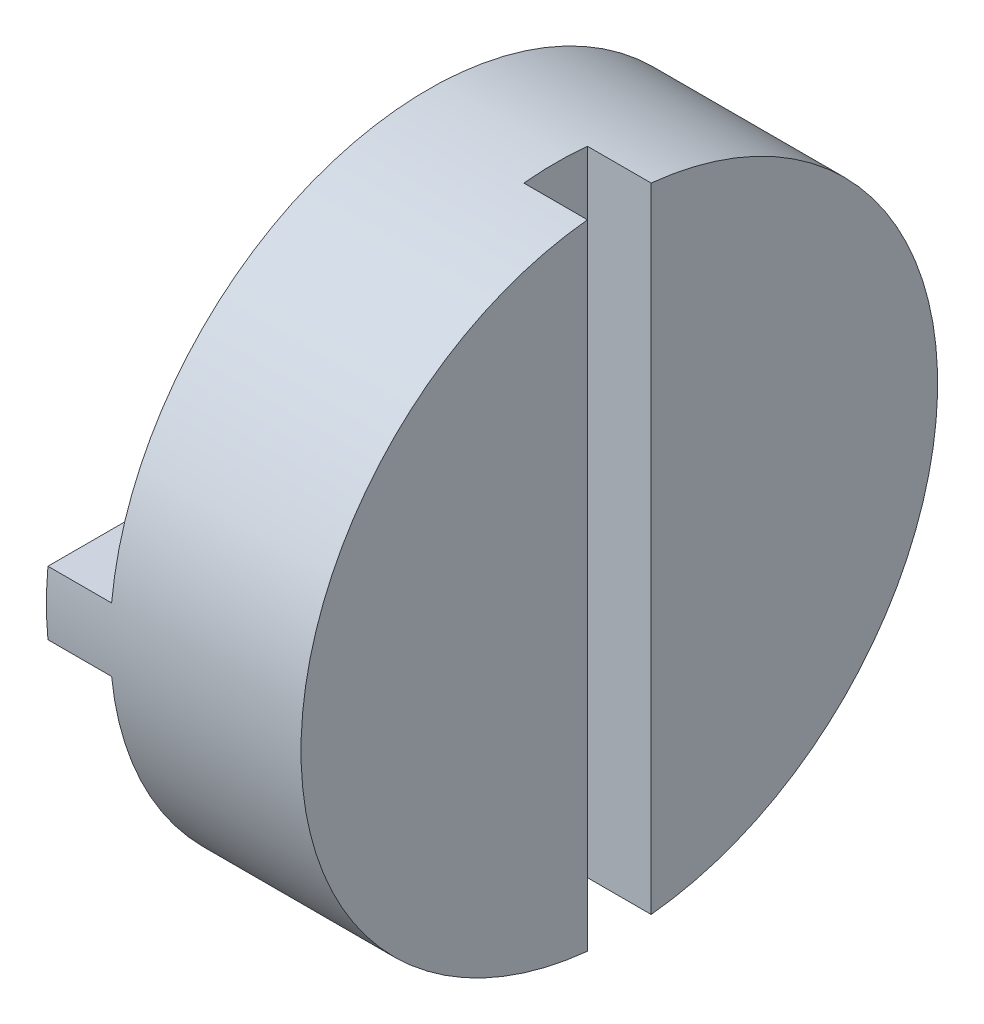
from build123d import *
from build123d.topology import SkipClean

# Parameters (mm, degrees)
BOSS_EXTRUDE1_DEPTH      = 10
BOSS_EXTRUDE1_DEPTH_BACK = 5
SKETCH1_R                = 25
CUT_EXTRUDE1_DEPTH       = 5
BOSS_EXTRUDE2_DEPTH      = 5


with BuildPart() as part:
    # Sketch1 → Boss-Extrude1 (new, two sides: drawn at the far end of the back side and taken through both)
    with BuildSketch(Plane(origin=(0, 0, 0), x_dir=(0, 0, -1), z_dir=(1, 0, 0)).offset(-BOSS_EXTRUDE1_DEPTH_BACK)):
        Circle(SKETCH1_R)
    extrude(amount=BOSS_EXTRUDE1_DEPTH + BOSS_EXTRUDE1_DEPTH_BACK)

    # Sketch2 → Cut-Extrude1 (cut)
    with BuildSketch(Plane(origin=(10, 0, 0), x_dir=(0, 0, -1), z_dir=(1, 0, 0))):
        with BuildLine():
            Line((2.5, 24.874685928), (2.5, -24.874685928))
            ThreePointArc((2.5, -24.874685928), (0, -25), (-2.5, -24.874685928))
            Line((-2.5, -24.874685928), (-2.5, 24.874685928))
            ThreePointArc((-2.5, 24.874685928), (0, 25), (2.5, 24.874685928))
        make_face()
    extrude(amount=-CUT_EXTRUDE1_DEPTH, mode=Mode.SUBTRACT)

    # Sketch4 → Boss-Extrude2 (add)
    with SkipClean():  # the faces are left unmerged after this step: merging them gives an invalid solid
        with BuildSketch(Plane.ZY.offset(5)):
            with BuildLine():
                Line((-24.874685928, -2.5), (24.874685928, -2.5))
                ThreePointArc((24.874685928, -2.5), (25, 0), (24.874685928, 2.5))
                Line((24.874685928, 2.5), (-24.874685928, 2.5))
                ThreePointArc((-24.874685928, 2.5), (-25, 0), (-24.874685928, -2.5))
            make_face()
        extrude(amount=BOSS_EXTRUDE2_DEPTH)


solid = part.part
